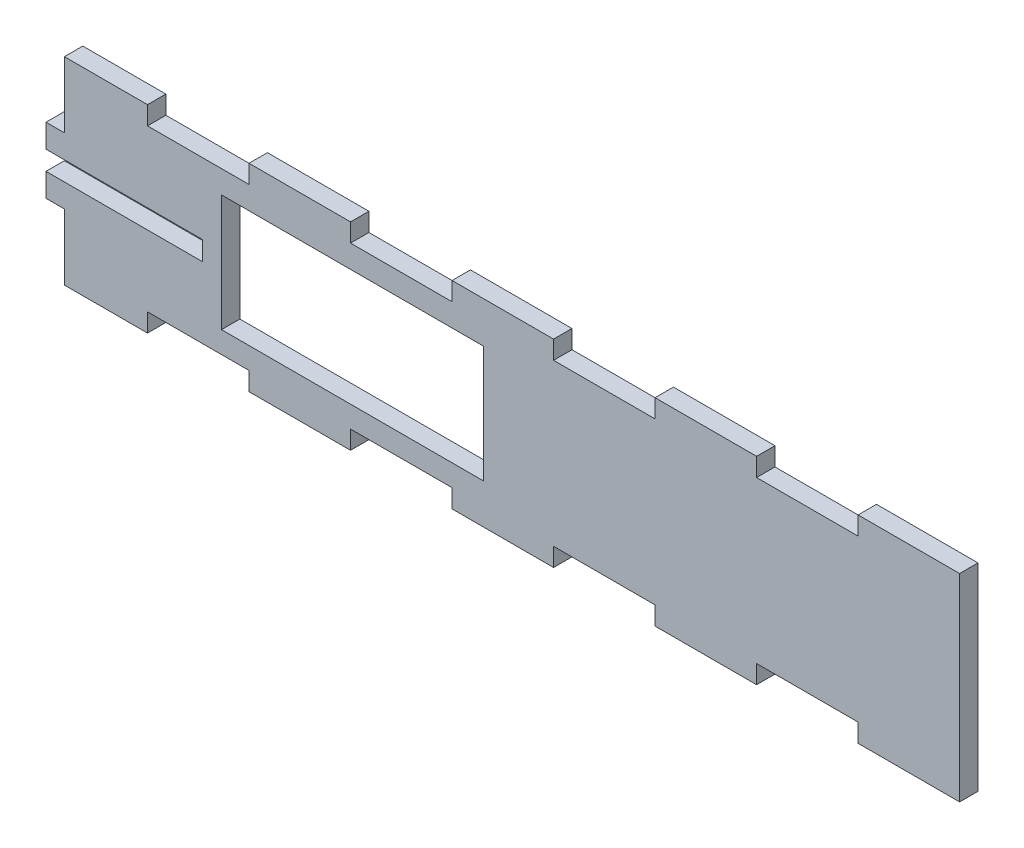
from build123d import *

# Parameters (mm, degrees)
SKETCH2_W           = 228.6
SKETCH2_H           = 49.499999806
BOSS_EXTRUDE1_DEPTH = 4.599999944
SKETCH4_W           = 25.4
SKETCH4_H           = 4.599999944
CUT_EXTRUDE1_DEPTH  = 234.943091328
SKETCH5_W           = 4.599999944
SKETCH5_H           = 16.499999935
CUT_EXTRUDE2_DEPTH  = 4.599999944
SKETCH6_W           = 65.500000064
SKETCH6_H           = 29.20000002
CUT_EXTRUDE3_DEPTH  = 270.181953409
SKETCH7_W           = 39.220017768
SKETCH7_H           = 4.800000052
CUT_EXTRUDE4_DEPTH  = 234.943091328


with BuildPart() as part:
    # Sketch2 → Boss-Extrude1 (new body)
    with BuildSketch(Plane.XY):
        with Locations((114.3, 24.749999903)):
            Rectangle(SKETCH2_W, SKETCH2_H)
    extrude(amount=BOSS_EXTRUDE1_DEPTH)

    # Sketch4 → Cut-Extrude1 (cut, through all)
    with BuildSketch(Plane.XY.offset(4.599999944)):
        with Locations((38.1, 2.299999972)):
            Rectangle(SKETCH4_W, SKETCH4_H)
        with Locations((88.9, 2.299999972)):
            Rectangle(SKETCH4_W, SKETCH4_H)
        with Locations((139.7, 2.299999972)):
            Rectangle(SKETCH4_W, SKETCH4_H)
        with Locations((190.5, 2.299999972)):
            Rectangle(SKETCH4_W, SKETCH4_H)
    cut_extrude1 = extrude(amount=-CUT_EXTRUDE1_DEPTH, mode=Mode.SUBTRACT)

    # Mirror1: Cut-Extrude1 across plane
    add(cut_extrude1.mirror(Plane.ZX.offset(24.749999903)), mode=Mode.SUBTRACT)

    # Sketch5 → Cut-Extrude2 (cut)
    with BuildSketch(Plane.ZY):
        with Locations((2.299999972, 41.249999839)):
            Rectangle(SKETCH5_W, SKETCH5_H)
        with Locations((2.299999972, 8.249999968)):
            Rectangle(SKETCH5_W, SKETCH5_H)
    extrude(amount=-CUT_EXTRUDE2_DEPTH, mode=Mode.SUBTRACT)

    # Sketch6 → Cut-Extrude3 (cut, through all)
    with BuildSketch(Plane(origin=(29.45757895, -124.715298599, 49.499999806), x_dir=(1, 0, 0), z_dir=(0, 0, 1))):
        with Locations((47.200087569, 149.315298548)):
            Rectangle(SKETCH6_W, SKETCH6_H)
    extrude(amount=-CUT_EXTRUDE3_DEPTH, mode=Mode.SUBTRACT)

    # Sketch7 → Cut-Extrude4 (cut, through all)
    with BuildSketch(Plane(origin=(0, 0, 0), x_dir=(-1, 0, 0), z_dir=(0, 0, -1))):
        with Locations((-19.610008884, 24.749999903)):
            Rectangle(SKETCH7_W, SKETCH7_H)
    extrude(amount=-CUT_EXTRUDE4_DEPTH, mode=Mode.SUBTRACT)


solid = part.part
